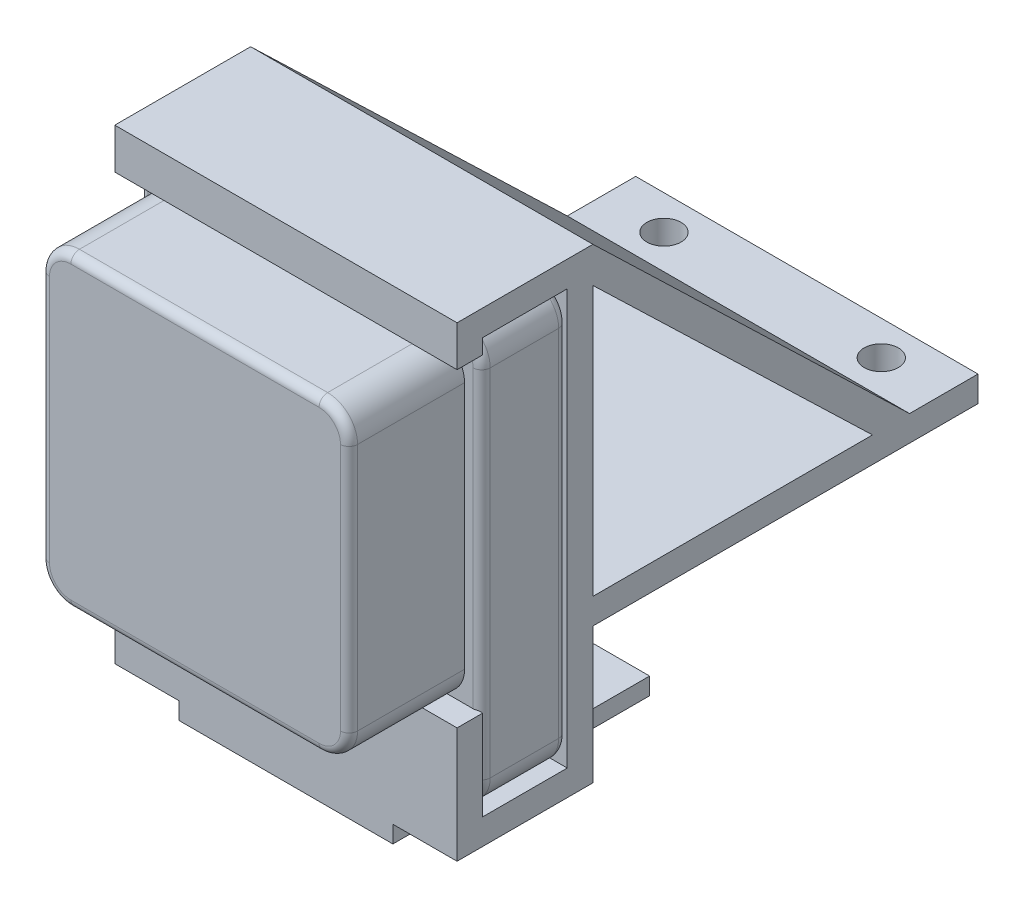
from build123d import *

# Parameters (mm, degrees)
SKETCH1_W                       = 36
SKETCH1_H                       = 36
BOSS_EXTRUDE1_DEPTH             = 13.5
SKETCH1_3_W                     = 40
SKETCH1_3_H                     = 48.5
SKETCH1_3_W_2                   = 36
SKETCH1_3_H_2                   = 36
BOSS_EXTRUDE2_DEPTH             = 10
FILLET1_R                       = 3.5
FILLET2_R                       = 3.5
FILLET3_R                       = 1
FILLET4_R                       = 1
FILLET5_R                       = 1
BOSS_EXTRUDE3_REACH             = 39.343
BOSS_EXTRUDE3_DIRECTION_2_REACH = 39.343
BOSS_EXTRUDE4_REACH             = 41.68
BOSS_EXTRUDE4_DIRECTION_2_REACH = 41.68
BOSS_EXTRUDE5_DEPTH             = 12.5
SKETCH9_R                       = 2
CUT_EXTRUDE3_DEPTH              = 71.944630699


with BuildPart() as part:
    # Sketch1 → Boss-Extrude1 (new body)
    with BuildSketch(Plane.XY):
        Rectangle(SKETCH1_W, SKETCH1_H)
    extrude(amount=BOSS_EXTRUDE1_DEPTH)

    # Fillet2
    fillet2_edges = [part.edges().sort_by_distance(p)[0] for p in [
        (-18, 18, 6.75),
        (-18, -18, 6.75),
        (18, -18, 6.75),
        (18, 18, 6.75),
    ]]
    fillet(fillet2_edges, radius=FILLET2_R)

    # Fillet5
    fillet5_edges = [part.edges().sort_by_distance(p)[0] for p in [
        (0, 18, 13.5),
        (18, 0, 13.5),
        (-18, 0, 13.5),
        (0, -18, 13.5),
        (-16.974873734, 16.974873734, 13.5),
        (-16.974873734, -16.974873734, 13.5),
        (16.974873734, -16.974873734, 13.5),
        (16.974873734, 16.974873734, 13.5),
    ]]
    fillet(fillet5_edges, radius=FILLET5_R)


with BuildPart() as body_2:
    # Sketch1<3> → Boss-Extrude2 (new body)
    # profile 1 of 2: a face of its own
    with BuildSketch(Plane.XY):
        with Locations((0, -4.25)):
            Rectangle(SKETCH1_3_W, SKETCH1_3_H)
        Rectangle(SKETCH1_3_W_2, SKETCH1_3_H_2, mode=Mode.SUBTRACT)
    # profile 2 of 2: a face of its own
    with BuildSketch(Plane.XY):
        Rectangle(SKETCH1_3_W_2, SKETCH1_3_H_2)
    extrude(amount=-BOSS_EXTRUDE2_DEPTH)

    # Fillet1
    fillet1_edges = [body_2.edges().sort_by_distance(p)[0] for p in [
        (20, -28.5, -5),
        (-20, -28.5, -5),
        (-20, 20, -5),
        (20, 20, -5),
    ]]
    fillet(fillet1_edges, radius=FILLET1_R)

    # Fillet3
    fillet3_edges = [body_2.edges().sort_by_distance(p)[0] for p in [
        (20, -4.25, 0),
        (0, 20, 0),
        (-20, -4.25, 0),
        (0, -28.5, 0),
        (-18.974873734, 18.974873734, 0),
        (18.974873734, -27.474873734, 0),
        (-18.974873734, -27.474873734, 0),
        (18.974873734, 18.974873734, 0),
    ]]
    fillet(fillet3_edges, radius=FILLET3_R)

    # Fillet4
    fillet4_edges = [body_2.edges().sort_by_distance(p)[0] for p in [
        (20, -4.25, -10),
        (0, 20, -10),
        (0, -28.5, -10),
        (-20, -4.25, -10),
        (-18.974873734, 18.974873734, -10),
        (18.974873734, -27.474873734, -10),
        (-18.974873734, -27.474873734, -10),
        (18.974873734, 18.974873734, -10),
    ]]
    fillet(fillet4_edges, radius=FILLET4_R)


with BuildPart() as body_3:

    # Boss-Extrude3: up to this face of the body (flat: up to its plane)
    boss_extrude3_end = Plane(body_2.part.faces().sort_by_distance((20, -4.25, -5))[0])
    # Sketch2 → Boss-Extrude3 (new, up to the picked face)
    with BuildSketch(Plane(origin=(0, 0, 0), x_dir=(0, 0, -1), z_dir=(1, 0, 0)), mode=Mode.PRIVATE) as boss_extrude3_sk1:
        Polygon((-2.875, -18), (-2.875, -31.5), (13, -31.5), (13, 20), (13, 23), (-2.875, 23), (-2.875, 18.25), (0.125, 18.25), (0.125, 20), (10, 20), (10, -28.5), (0.125, -28.5), (0.125, -18), align=None)
    boss_extrude3_tool1 = split(extrude(boss_extrude3_sk1.sketch, amount=BOSS_EXTRUDE3_REACH, mode=Mode.PRIVATE), bisect_by=boss_extrude3_end, keep=Keep.BOTH, mode=Mode.PRIVATE)
    add(boss_extrude3_tool1.solids().sort_by(Axis((0, -24.75, 2.30735), (1, 0, 0)))[0])


    # Boss-Extrude3 direction 2: up to this face of the body (flat: up to its plane)
    boss_extrude3_direction_2_end = Plane(body_2.part.faces().sort_by_distance((-20, -4.25, -5))[0])
    # Sketch2 → Boss-Extrude3 direction 2 (add, up to the picked face)
    with BuildSketch(Plane(origin=(0, 0, 0), x_dir=(0, 0, -1), z_dir=(1, 0, 0)), mode=Mode.PRIVATE) as boss_extrude3_direction_2_sk1:
        Polygon((-2.875, -18), (-2.875, -31.5), (13, -31.5), (13, 20), (13, 23), (-2.875, 23), (-2.875, 18.25), (0.125, 18.25), (0.125, 20), (10, 20), (10, -28.5), (0.125, -28.5), (0.125, -18), align=None)
    boss_extrude3_direction_2_tool1 = split(extrude(boss_extrude3_direction_2_sk1.sketch, amount=-BOSS_EXTRUDE3_DIRECTION_2_REACH, mode=Mode.PRIVATE), bisect_by=boss_extrude3_direction_2_end, keep=Keep.BOTH, mode=Mode.PRIVATE)
    add(boss_extrude3_direction_2_tool1.solids().sort_by(Axis((0, -24.75, 2.30735), (-1, 0, 0)))[0])


    # Boss-Extrude4: up to this face of the body (flat: up to its plane)
    boss_extrude4_end = Plane(body_2.part.faces().sort_by_distance((20, -4.25, -5))[0])
    # Sketch3 → Boss-Extrude4 (add, up to the picked face)
    with BuildSketch(Plane(origin=(0, 0, 0), x_dir=(0, 0, -1), z_dir=(1, 0, 0)), mode=Mode.PRIVATE) as boss_extrude4_sk1:
        Polygon((58, -15.625), (10, -15.625), (10, 23), (13, 23), (50, -12.625), (58, -12.625), align=None)
        Polygon((13, 18.835445964), (13, -12.625), (45.674708791, -12.625), align=None, mode=Mode.SUBTRACT)
    boss_extrude4_tool1 = split(extrude(boss_extrude4_sk1.sketch, amount=BOSS_EXTRUDE4_REACH, mode=Mode.PRIVATE), bisect_by=boss_extrude4_end, keep=Keep.BOTH, mode=Mode.PRIVATE)
    add(boss_extrude4_tool1.solids().sort_by(Axis((0, -15.008892, -34), (1, 0, 0)))[0])


    # Boss-Extrude4 direction 2: up to this face of the body (flat: up to its plane)
    boss_extrude4_direction_2_end = Plane(body_2.part.faces().sort_by_distance((-20, -4.25, -5))[0])
    # Sketch3 → Boss-Extrude4 direction 2 (add, up to the picked face)
    with BuildSketch(Plane(origin=(0, 0, 0), x_dir=(0, 0, -1), z_dir=(1, 0, 0)), mode=Mode.PRIVATE) as boss_extrude4_direction_2_sk1:
        Polygon((58, -15.625), (10, -15.625), (10, 23), (13, 23), (50, -12.625), (58, -12.625), align=None)
        Polygon((13, 18.835445964), (13, -12.625), (45.674708791, -12.625), align=None, mode=Mode.SUBTRACT)
    boss_extrude4_direction_2_tool1 = split(extrude(boss_extrude4_direction_2_sk1.sketch, amount=-BOSS_EXTRUDE4_DIRECTION_2_REACH, mode=Mode.PRIVATE), bisect_by=boss_extrude4_direction_2_end, keep=Keep.BOTH, mode=Mode.PRIVATE)
    add(boss_extrude4_direction_2_tool1.solids().sort_by(Axis((0, -15.008892, -34), (-1, 0, 0)))[0])

    # Sketch8 → Boss-Extrude5 (add, symmetric)
    with BuildSketch(Plane(origin=(0, 0, 0), x_dir=(0, 0, -1), z_dir=(1, 0, 0))):
        Polygon((-2.875, -31.5), (-2.875, -33.5), (27.125, -33.5), (27.125, -31.5), (13, -31.5), align=None)
    extrude(amount=BOSS_EXTRUDE5_DEPTH, both=True)

    # Sketch9 → Cut-Extrude3 (cut, through all)
    with BuildSketch(Plane(origin=(0, -12.625, 0), x_dir=(1, 0, 0), z_dir=(0, 1, 0))):
        with Locations(Location((12.7, 54, 0), (0, 0, 270))):
            Circle(SKETCH9_R)
        with Locations(Location((-12.7, 54, 0), (0, 0, 270))):
            Circle(SKETCH9_R)
    extrude(amount=-CUT_EXTRUDE3_DEPTH, mode=Mode.SUBTRACT)


solid = Compound([part.part, body_2.part, body_3.part])
